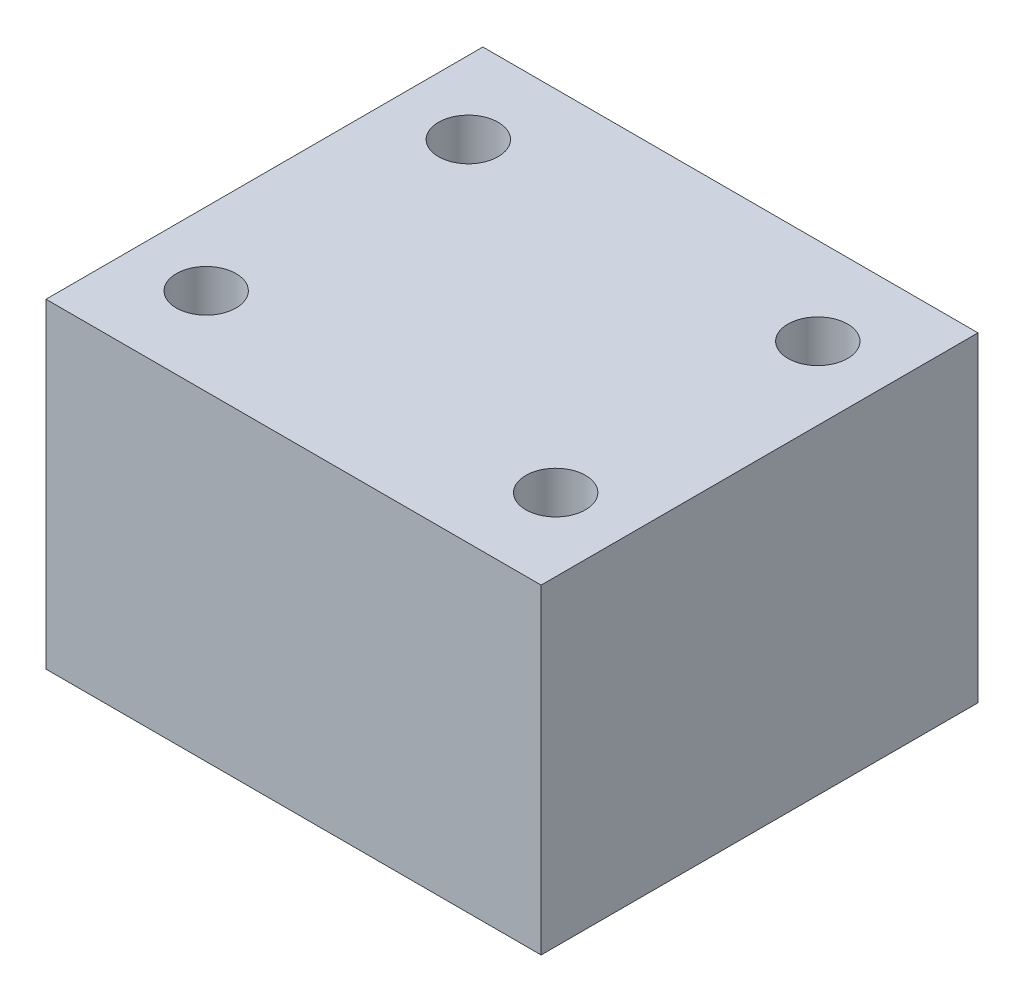
from build123d import *

# Parameters (mm, degrees)
SKETCH2_W           = 34
SKETCH2_H           = 22
BOSS_EXTRUDE1_DEPTH = 30
SKETCH3_R           = 2.05
CUT_EXTRUDE1_DEPTH  = 30


with BuildPart() as part:
    # Sketch2 → Boss-Extrude1 (new body)
    with BuildSketch(Plane.XY):
        with Locations((17, 11)):
            Rectangle(SKETCH2_W, SKETCH2_H)
    extrude(amount=-BOSS_EXTRUDE1_DEPTH)

    # Sketch3 → Cut-Extrude1 (cut)
    with BuildSketch(Plane(origin=(0, 22, 0), x_dir=(1, 0, 0), z_dir=(0, 1, 0))):
        with Locations(Location((29, 6, 0), (0, 0, 270))):
            Circle(SKETCH3_R)
        with Locations(Location((5, 6, 0), (0, 0, 270))):
            Circle(SKETCH3_R)
        with Locations(Location((5, 24, 0), (0, 0, 270))):
            Circle(SKETCH3_R)
        with Locations(Location((29, 24, 0), (0, 0, 270))):
            Circle(SKETCH3_R)
    extrude(amount=-CUT_EXTRUDE1_DEPTH, mode=Mode.SUBTRACT)


solid = part.part
